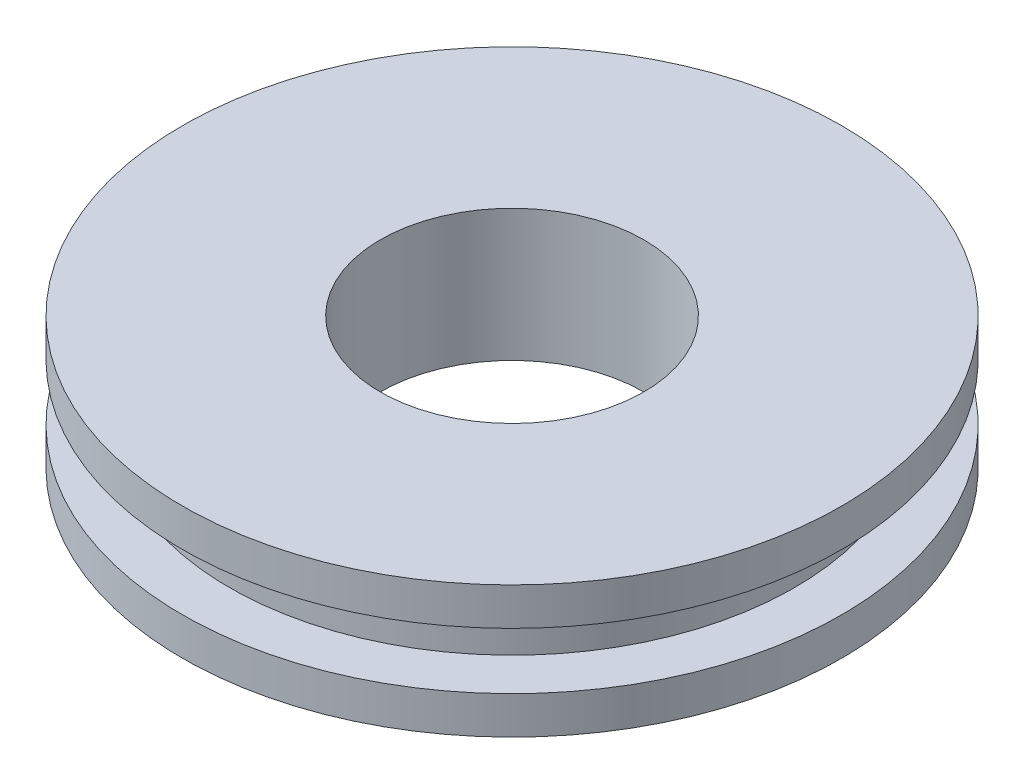
from build123d import *


with BuildPart() as part:
    # Sketch1 → Revolve1 (revolve)
    with BuildSketch(Plane.XY, mode=Mode.PRIVATE) as revolve1_sk:
        Polygon((7, 3.5), (17.5, 3.5), (17.5, 1.5), (15, 1.5), (15, -1.5), (17.5, -1.5), (17.5, -3.5), (7, -3.5), align=None)
    revolve(revolve1_sk.sketch.rotate(Axis((0, 0, 0), (0, 1, 0)), 90), axis=Axis((0, 0, 0), (0, 1, 0)))


solid = part.part
